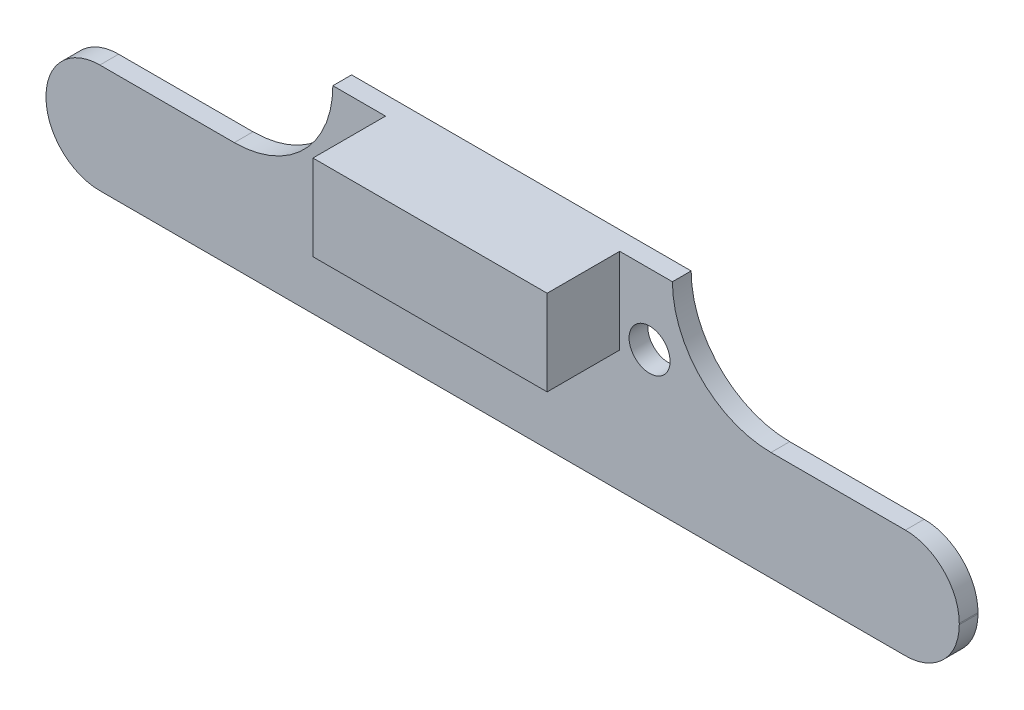
from build123d import *

# Parameters (mm, degrees)
ESQUISSE1_R        = 1.75
BOSS_EXTRU_1_DEPTH = 1.6
ESQUISSE2_W        = 20
ESQUISSE2_H        = 7.3
BOSS_EXTRU_2_DEPTH = 6.2


with BuildPart() as part:
    # Esquisse1 → Boss.-Extru.1 (new body)
    with BuildSketch(Plane.XY):
        with BuildLine():
            Line((4.6, 0), (73.4, 0))
            ThreePointArc((73.4, 0), (76.652691193, 1.347308807), (78, 4.6))
            Line((78, 4.6), (78, 4.7))
            ThreePointArc((78, 4.7), (76.652691193, 7.952691193), (73.4, 9.3))
            Line((73.4, 9.3), (61.92, 9.3))
            ThreePointArc((61.92, 9.3), (55.966160902, 11.766160902), (53.5, 17.72))
            Line((53.5, 17.72), (24.5, 17.72))
            ThreePointArc((24.5, 17.72), (22.033839098, 11.766160902), (16.08, 9.3))
            Line((16.08, 9.3), (4.6, 9.3))
            ThreePointArc((4.6, 9.3), (1.347308807, 7.952691193), (0, 4.7))
            Line((0, 4.7), (0, 4.6))
            ThreePointArc((0, 4.6), (1.347308807, 1.347308807), (4.6, 0))
        make_face()
        with Locations((26.45, 11.72)):
            Circle(ESQUISSE1_R, mode=Mode.SUBTRACT)
        with Locations(Location((51.55, 11.72, 0), (0, 0, 180))):
            Circle(ESQUISSE1_R, mode=Mode.SUBTRACT)
    extrude(amount=BOSS_EXTRU_1_DEPTH)

    # Esquisse2 → Boss.-Extru.2 (add)
    with BuildSketch(Plane.XY.offset(1.6)):
        with Locations((39, 14.07)):
            Rectangle(ESQUISSE2_W, ESQUISSE2_H)
    extrude(amount=BOSS_EXTRU_2_DEPTH)


solid = part.part
